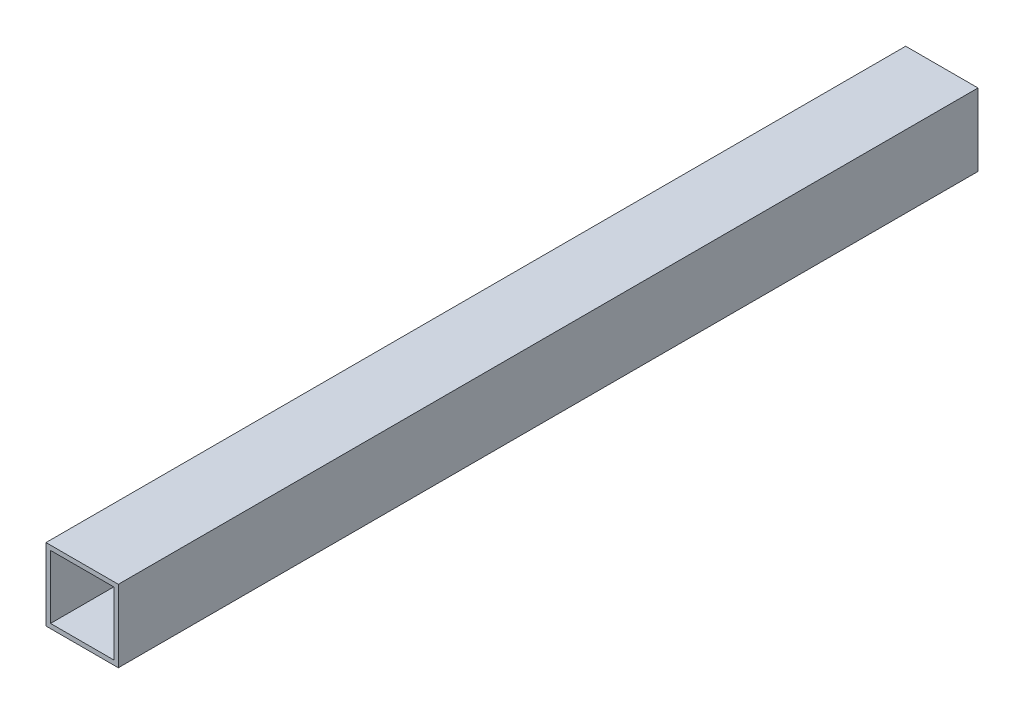
from build123d import *

# Parameters (mm, degrees)
SKETCH1_W           = 25.4
SKETCH1_H           = 25.4
SKETCH1_W_2         = 22.225
SKETCH1_H_2         = 22.225
BOSS_EXTRUDE1_DEPTH = 150.969853


with BuildPart() as part:
    # Sketch1 → Boss-Extrude1 (new, symmetric)
    with BuildSketch(Plane.XY):
        Rectangle(SKETCH1_W, SKETCH1_H)
        Rectangle(SKETCH1_W_2, SKETCH1_H_2, mode=Mode.SUBTRACT)
    extrude(amount=BOSS_EXTRUDE1_DEPTH, both=True)


solid = part.part
